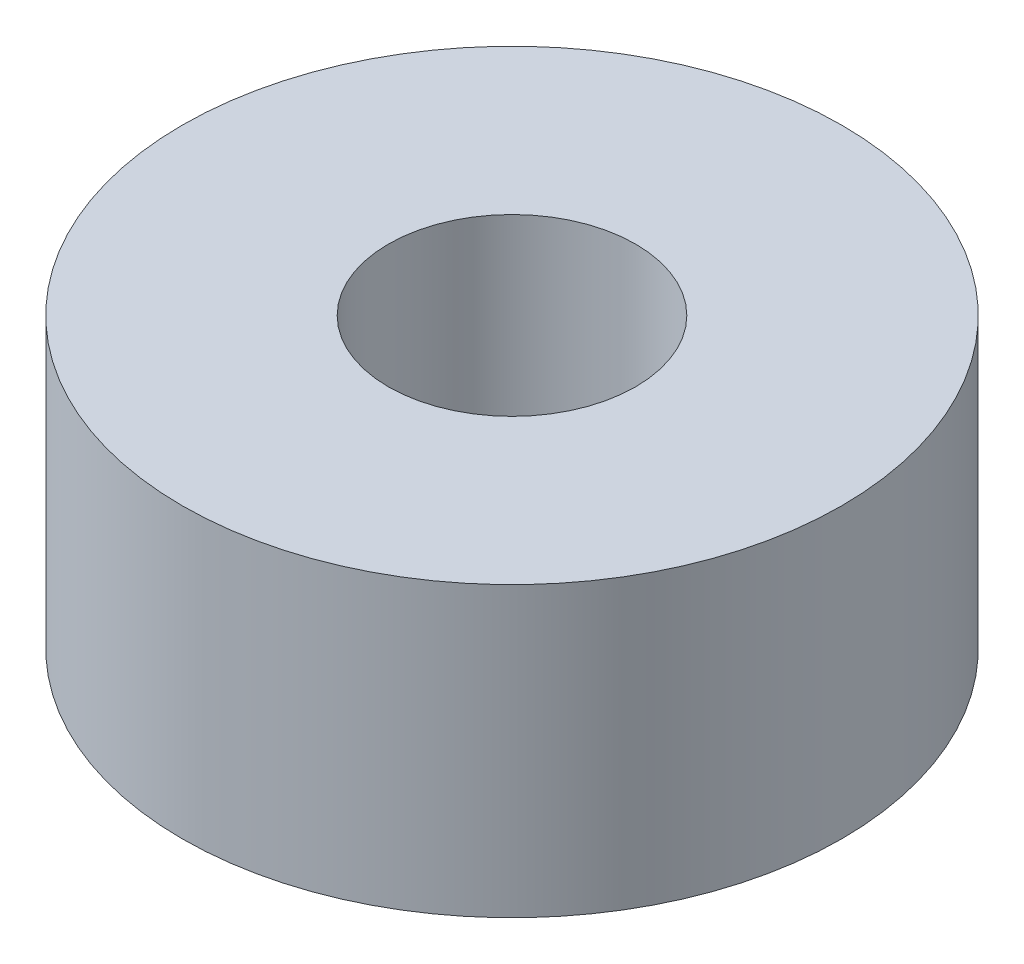
from build123d import *

# Parameters (mm, degrees)
SKETCH1_R           = 4
SKETCH1_R_2         = 1.5
BOSS_EXTRUDE1_DEPTH = 3.5


with BuildPart() as part:
    # Sketch1 → Boss-Extrude1 (new body)
    with BuildSketch(Plane(origin=(0, 0, 0), x_dir=(1, 0, 0), z_dir=(0, 1, 0))):
        with Locations(Location((0, 0, 0), (0, 0, 270))):
            Circle(SKETCH1_R)
        with Locations(Location((0, 0, 0), (0, 0, 270))):
            Circle(SKETCH1_R_2, mode=Mode.SUBTRACT)
    extrude(amount=BOSS_EXTRUDE1_DEPTH)


solid = part.part
